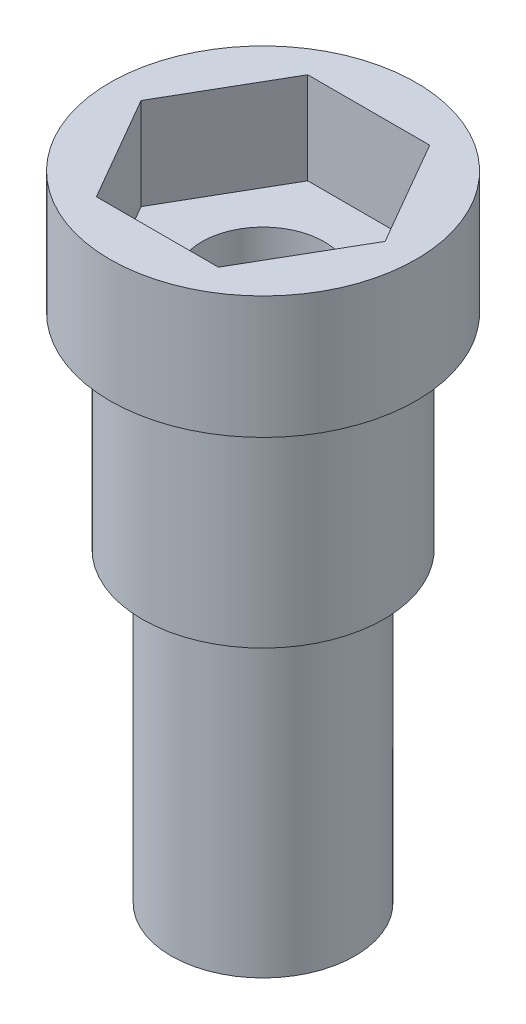
from build123d import *

# Parameters (mm, degrees)
SKETCH1_R           = 3
SKETCH1_R_2         = 2
BOSS_EXTRUDE1_DEPTH = 18
BOSS_EXTRUDE3_START = -8
SKETCH2_R           = 3.95
SKETCH2_R_2         = 2
BOSS_EXTRUDE3_DEPTH = 6.7
SKETCH4_R           = 5
SKETCH4_R_2         = 2
BOSS_EXTRUDE4_DEPTH = 4
CUT_EXTRUDE1_DEPTH  = 3


with BuildPart() as part:
    # Sketch1 → Boss-Extrude1 (new body)
    with BuildSketch(Plane(origin=(0, 0, 0), x_dir=(1, 0, 0), z_dir=(0, 1, 0))):
        with Locations(Location((0, 0, 0), (0, 0, 270))):
            Circle(SKETCH1_R)
        with Locations(Location((0, 0, 0), (0, 0, 270))):
            Circle(SKETCH1_R_2, mode=Mode.SUBTRACT)
    extrude(amount=BOSS_EXTRUDE1_DEPTH)

    # Sketch2 → Boss-Extrude3 (add)
    with BuildSketch(Plane(origin=(0, 18, 0), x_dir=(1, 0, 0), z_dir=(0, 1, 0)).offset(BOSS_EXTRUDE3_START)):
        with Locations(Location((0, 0, 0), (0, 0, 270))):
            Circle(SKETCH2_R)
        with Locations(Location((0, 0, 0), (0, 0, 270))):
            Circle(SKETCH2_R_2, mode=Mode.SUBTRACT)
    extrude(amount=BOSS_EXTRUDE3_DEPTH)

    # Sketch4 → Boss-Extrude4 (add)
    with BuildSketch(Plane(origin=(0, 16.7, 0), x_dir=(1, 0, 0), z_dir=(0, 1, 0))):
        with Locations(Location((0, 0, 0), (0, 0, 270))):
            Circle(SKETCH4_R)
        with Locations(Location((0, 0, 0), (0, 0, 270))):
            Circle(SKETCH4_R_2, mode=Mode.SUBTRACT)
    extrude(amount=BOSS_EXTRUDE4_DEPTH)

    # Sketch5 → Cut-Extrude1 (cut)
    with BuildSketch(Plane(origin=(0, 20.7, 0), x_dir=(1, 0, 0), z_dir=(0, 1, 0))):
        Polygon((3.983716857, 0), (1.991858429, 3.45), (-1.991858429, 3.45), (-3.983716857, 0), (-1.991858429, -3.45), (1.991858429, -3.45), align=None)
    extrude(amount=-CUT_EXTRUDE1_DEPTH, mode=Mode.SUBTRACT)


solid = part.part
